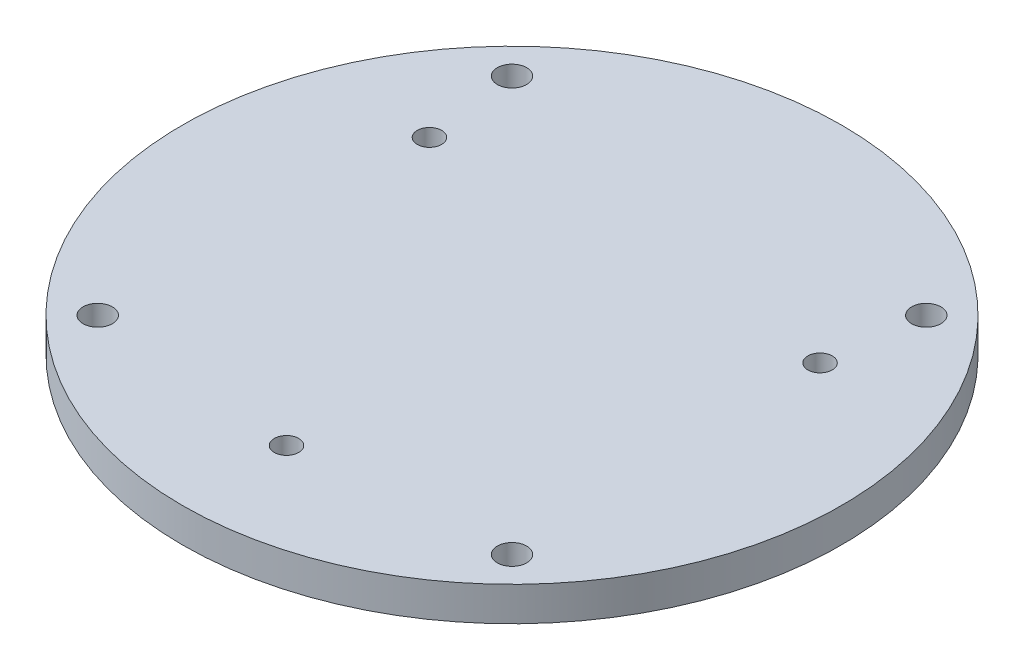
from build123d import *

# Parameters (mm, degrees)
SKETCH1_R           = 67.5
SKETCH1_R_2         = 2.5
BOSS_EXTRUDE1_DEPTH = 7
SKETCH3_R           = 3
CUT_EXTRUDE1_DEPTH  = 10


with BuildPart() as part:
    # Sketch1 → Boss-Extrude1 (new body)
    with BuildSketch(Plane(origin=(0, 0, 0), x_dir=(1, 0, 0), z_dir=(0, 1, 0))):
        with Locations(Location((0, 0, 0), (0, 0, 270))):
            Circle(SKETCH1_R)
        with Locations(Location((-40, 23.094010768, 0), (0, 0, 270))):
            Circle(SKETCH1_R_2, mode=Mode.SUBTRACT)
        with Locations(Location((40, 23.094010768, 0), (0, 0, 270))):
            Circle(SKETCH1_R_2, mode=Mode.SUBTRACT)
        with Locations(Location((0, -46.188021535, 0), (0, 0, 270))):
            Circle(SKETCH1_R_2, mode=Mode.SUBTRACT)
    extrude(amount=BOSS_EXTRUDE1_DEPTH)

    # Sketch3 → Cut-Extrude1 (cut)
    with BuildSketch(Plane(origin=(0, 7, 0), x_dir=(1, 0, 0), z_dir=(0, 1, 0))):
        with Locations(Location((42.425, 42.425, 0), (0, 0, 270))):
            Circle(SKETCH3_R)
        with Locations(Location((42.425, -42.425, 0), (0, 0, 270))):
            Circle(SKETCH3_R)
        with Locations(Location((-42.425, -42.425, 0), (0, 0, 270))):
            Circle(SKETCH3_R)
        with Locations(Location((-42.425, 42.425, 0), (0, 0, 270))):
            Circle(SKETCH3_R)
    extrude(amount=-CUT_EXTRUDE1_DEPTH, mode=Mode.SUBTRACT)


solid = part.part
